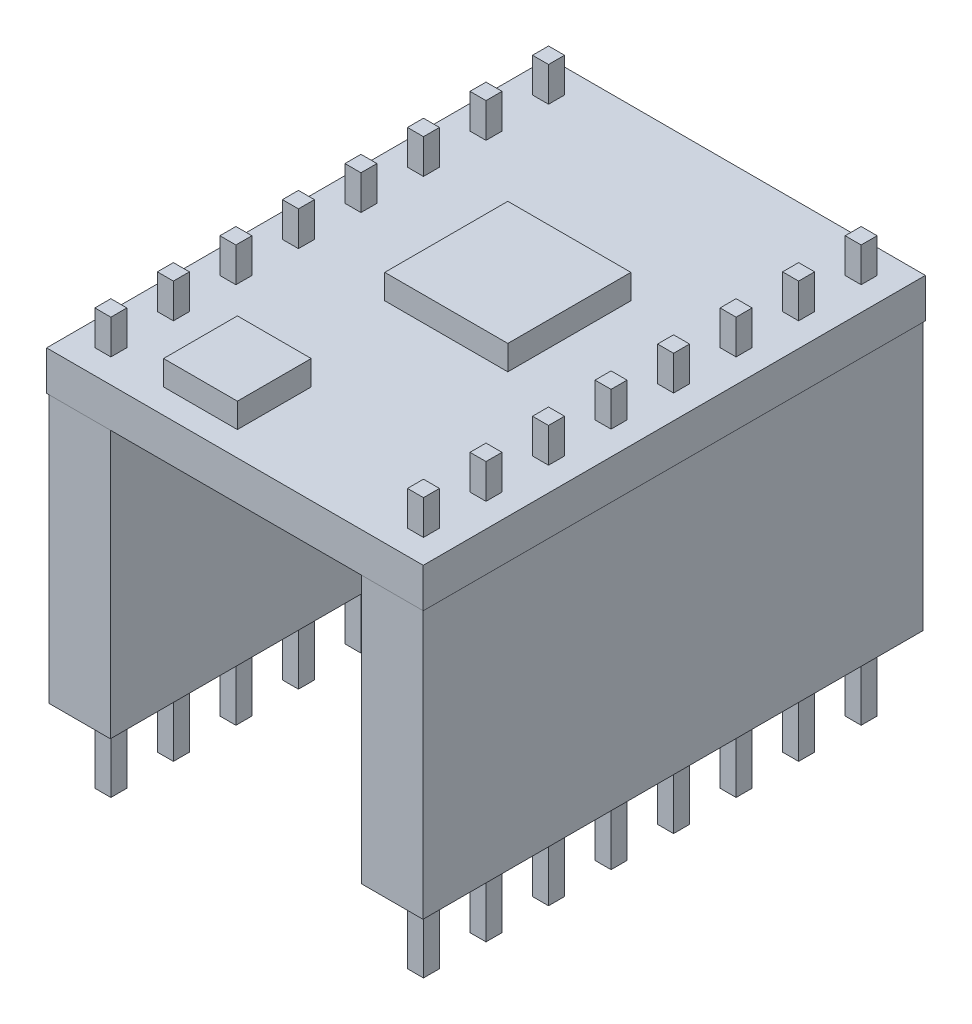
from build123d import *

# Parameters (mm, degrees)
ESQUISSE1_W             = 15.3
ESQUISSE1_H             = 20.4
BOSS_EXTRU_1_DEPTH      = 1.6
ESQUISSE2_W             = 2.5
ESQUISSE2_H             = 20.32
BOSS_EXTRU_2_DEPTH      = 10.9
BOSS_EXTRU_3_DEPTH      = 3
BOSS_EXTRU_3_DEPTH_BACK = 13.9
ESQUISSE3_W             = 0.65
ESQUISSE3_H             = 0.65
ESQUISSE4_W             = 5
ESQUISSE4_H             = 5
ESQUISSE4_W_2           = 3
ESQUISSE4_H_2           = 3
BOSS_EXTRU_4_DEPTH      = 1


with BuildPart() as part:
    # Esquisse1 → Boss.-Extru.1 (new body)
    with BuildSketch(Plane(origin=(0, 0, 0), x_dir=(1, 0, 0), z_dir=(0, 1, 0))):
        Rectangle(ESQUISSE1_W, ESQUISSE1_H)
    extrude(amount=BOSS_EXTRU_1_DEPTH)

    # Esquisse2 → Boss.-Extru.2 (add)
    with BuildSketch(Plane(origin=(0, 0, 0), x_dir=(1, 0, 0), z_dir=(0, 1, 0))):
        with Locations((-6.35, 0)):
            Rectangle(ESQUISSE2_W, ESQUISSE2_H)
        with Locations((6.35, 0)):
            Rectangle(ESQUISSE2_W, ESQUISSE2_H)
    extrude(amount=-BOSS_EXTRU_2_DEPTH)

    # Esquisse3 → Boss.-Extru.3 (add, two sides: drawn at the far end of the back side and taken through both)
    with BuildSketch(Plane.XZ.offset(10.9).offset(-BOSS_EXTRU_3_DEPTH_BACK)):
        with Locations((-6.35, 1.27)):
            Rectangle(ESQUISSE3_W, ESQUISSE3_H)
        with Locations((-6.35, -1.27)):
            Rectangle(ESQUISSE3_W, ESQUISSE3_H)
        with Locations((-6.35, 3.81)):
            Rectangle(ESQUISSE3_W, ESQUISSE3_H)
        with Locations((-6.35, 6.35)):
            Rectangle(ESQUISSE3_W, ESQUISSE3_H)
        with Locations((-6.35, 8.89)):
            Rectangle(ESQUISSE3_W, ESQUISSE3_H)
        with Locations((-6.35, -8.89)):
            Rectangle(ESQUISSE3_W, ESQUISSE3_H)
        with Locations((-6.35, -6.35)):
            Rectangle(ESQUISSE3_W, ESQUISSE3_H)
        with Locations((-6.35, -3.81)):
            Rectangle(ESQUISSE3_W, ESQUISSE3_H)
        with Locations((6.35, -8.89)):
            Rectangle(ESQUISSE3_W, ESQUISSE3_H)
        with Locations((6.35, -6.35)):
            Rectangle(ESQUISSE3_W, ESQUISSE3_H)
        with Locations((6.35, -3.81)):
            Rectangle(ESQUISSE3_W, ESQUISSE3_H)
        with Locations((6.35, 1.27)):
            Rectangle(ESQUISSE3_W, ESQUISSE3_H)
        with Locations((6.35, -1.27)):
            Rectangle(ESQUISSE3_W, ESQUISSE3_H)
        with Locations((6.35, 3.81)):
            Rectangle(ESQUISSE3_W, ESQUISSE3_H)
        with Locations((6.35, 6.35)):
            Rectangle(ESQUISSE3_W, ESQUISSE3_H)
        with Locations((6.35, 8.89)):
            Rectangle(ESQUISSE3_W, ESQUISSE3_H)
    extrude(amount=BOSS_EXTRU_3_DEPTH + BOSS_EXTRU_3_DEPTH_BACK)

    # Esquisse4 → Boss.-Extru.4 (add)
    with BuildSketch(Plane(origin=(0, 1.6, 0), x_dir=(1, 0, 0), z_dir=(0, 1, 0))):
        with Locations((0.061900131, 0.824485309)):
            Rectangle(ESQUISSE4_W, ESQUISSE4_H)
        with Locations((-2.4, -7.7)):
            Rectangle(ESQUISSE4_W_2, ESQUISSE4_H_2)
    extrude(amount=BOSS_EXTRU_4_DEPTH)


solid = part.part
